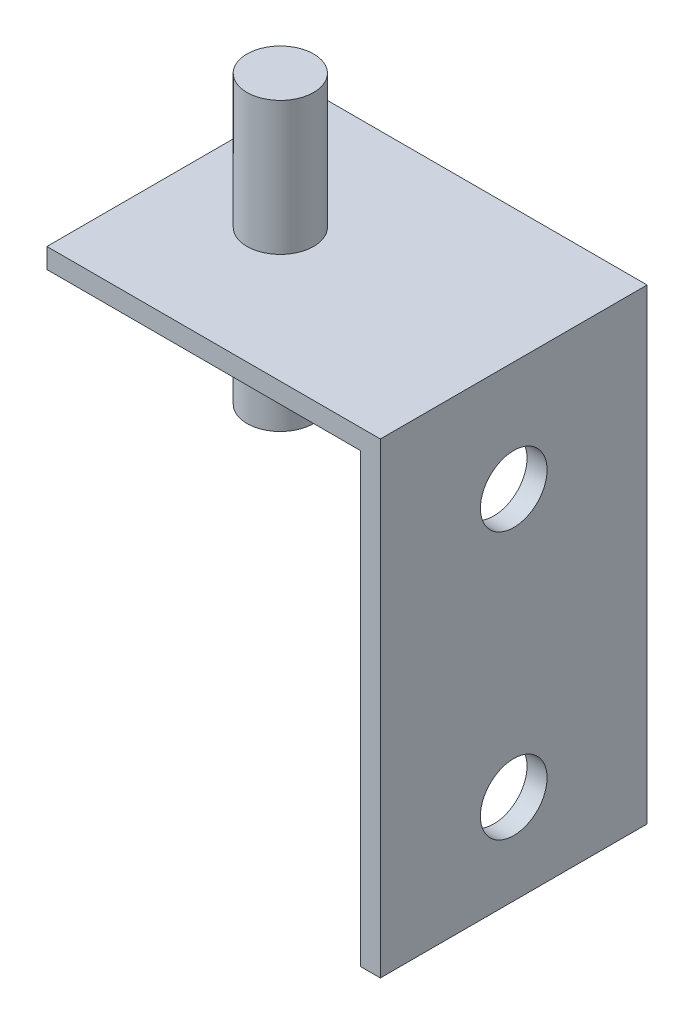
from build123d import *

# Parameters (mm, degrees)
SUPERFICIE_EXTRUIR1_1_DEPTH = 40
DAR_ESPESOR1_T1             = 3
EXTRUIR1_DEPTH              = 20
EXTRUIR1_DEPTH_BACK         = 23
CROQUIS2_R                  = 5
CROQUIS3_R                  = 5
EXTRUIR2_DEPTH              = 20


with BuildPart() as body_1:
    # Superficie-Extruir1: a surface, the sketch's curves swept straight by 40 mm
    with BuildLine(Plane.XY, mode=Mode.PRIVATE) as superficie_extruir1_1_path:
        Line((0, -70), (0, 0))
        Line((0, 0), (-50, 0))
    superficie_extruir1_1 = Shell.extrude(superficie_extruir1_1_path.wire(), (0 * SUPERFICIE_EXTRUIR1_1_DEPTH, 0 * SUPERFICIE_EXTRUIR1_1_DEPTH, 1 * SUPERFICIE_EXTRUIR1_1_DEPTH))
    add(Solid.thicken(superficie_extruir1_1, DAR_ESPESOR1_T1))

    # Croquis2 → Extruir1 (add, two sides: drawn at the far end of the back side and taken through both)
    with BuildSketch(Plane(origin=(0, 0, 0), x_dir=(1, 0, 0), z_dir=(0, 1, 0)).offset(-EXTRUIR1_DEPTH_BACK)):
        with Locations(Location((-35, -20, 0), (0, 0, 180))):
            Circle(CROQUIS2_R)
    extrude(amount=EXTRUIR1_DEPTH + EXTRUIR1_DEPTH_BACK)

    # Croquis3 → Extruir2 (cut)
    with BuildSketch(Plane.ZY.offset(3)):
        with Locations(Location((20, -56.5, 0), (0, 0, 270))):
            Circle(CROQUIS3_R)
        with Locations(Location((20, -16.5, 0), (0, 0, 90))):
            Circle(CROQUIS3_R)
    extrude(amount=-EXTRUIR2_DEPTH, mode=Mode.SUBTRACT)


solid = body_1.part
